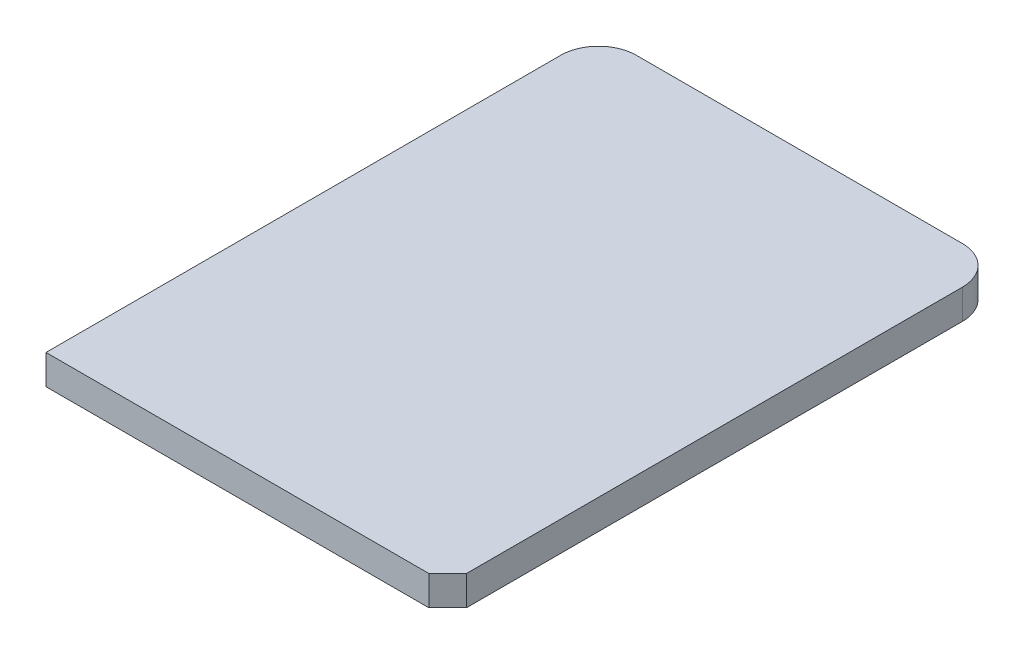
from build123d import *

# Parameters (mm, degrees)
BOSS_EXTRUDE2_DEPTH = 1.575


with BuildPart() as part:
    # Sketch2 → Boss-Extrude2 (new body)
    with BuildSketch(Plane(origin=(0, 0, 0), x_dir=(1, 0, 0), z_dir=(0, 1, 0))):
        with BuildLine():
            Line((0, 2), (0, 0))
            Line((0, 0), (2, 0))
            Line((2, 0), (20.3, 0))
            Line((20.3, 0), (21.3, 1))
            Line((21.3, 1), (21.3, 27.3))
            ThreePointArc((21.3, 27.3), (20.714213562, 28.714213562), (19.3, 29.3))
            Line((19.3, 29.3), (2, 29.3))
            ThreePointArc((2, 29.3), (0.585786438, 28.714213562), (0, 27.3))
            Line((0, 27.3), (0, 2))
        make_face()
    extrude(amount=BOSS_EXTRUDE2_DEPTH)


solid = part.part
